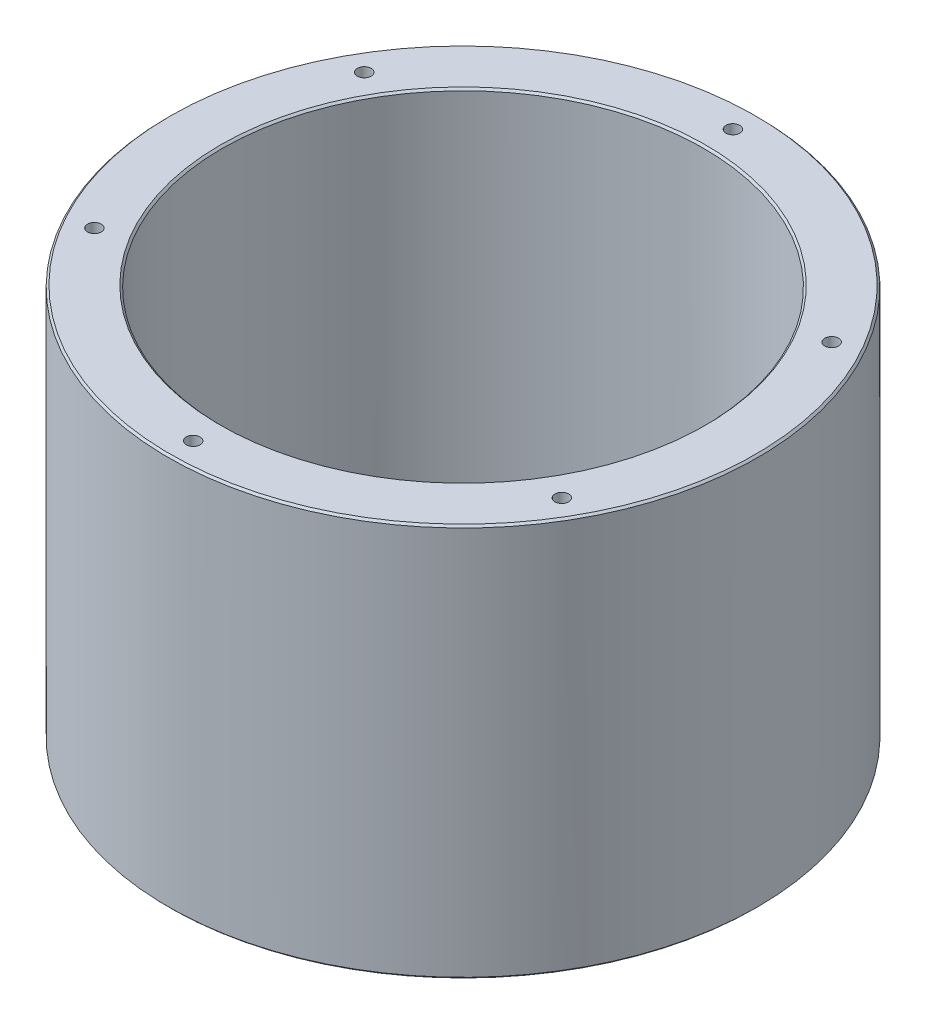
from build123d import *

# Parameters (mm, degrees)
SZKIC1_W                            = 27.5
SZKIC1_H                            = 200
SFAZOWANIE1_SIZE                    = 1
OTW_R_GWINTOWANY_M8X1_01_AT_2_COUNT = 2
OTW_R_GWINTOWANY_M8X1_01_AT_2_PITCH = 137.316
OTW_R_GWINTOWANY_M8X1_01_AT_3_COUNT = 2
OTW_R_GWINTOWANY_M8X1_01_AT_3_PITCH = 237.838288692
OTW_R_GWINTOWANY_M8X1_01_AT_4_COUNT = 2
OTW_R_GWINTOWANY_M8X1_01_AT_4_PITCH = 274.632
OTW_R_GWINTOWANY_M8X1_01_AT_5_COUNT = 2
OTW_R_GWINTOWANY_M8X1_01_AT_5_PITCH = 237.838288692
OTW_R_GWINTOWANY_M8X1_01_AT_6_COUNT = 2
OTW_R_GWINTOWANY_M8X1_01_AT_6_PITCH = 137.316


with BuildPart() as part:
    # Szkic1 → Obrót1 (revolve)
    with BuildSketch(Plane.XY):
        with Locations((-136.25, 73.59625624)):
            Rectangle(SZKIC1_W, SZKIC1_H)
    revolve(axis=Axis((0, 193.59625624, 0), (0, -1, 0)))

    # Sfazowanie1
    sfazowanie1_edges = [part.edges().sort_by_distance(p)[0] for p in [
        (150, 173.59625624, 0),
        (122.5, 173.59625624, 0),
        (122.5, -26.40374376, 0),
        (150, -26.40374376, 0),
    ]]
    chamfer(sfazowanie1_edges, length=SFAZOWANIE1_SIZE)

    # Szkic7 → Otwór gwintowany M8x1.01 (revolve, cut)
    with BuildSketch(Plane(origin=(0, 173.59625624, -137.316), x_dir=(0, 0, 1), z_dir=(1, 0, 0))):
        Polygon((0, 0), (0, 77.103012167), (3.5, 75), (3.5, 0), align=None)
    otw_r_gwintowany_m8x1_01 = revolve(axis=Axis((0, 179.94625624, -137.316), (0, -1, 0)), mode=Mode.SUBTRACT)

    # Otwór gwintowany M8x1.01 at 2: Otwór gwintowany M8x1.01 ×2
    with Locations(*[Vector(0.8660254037844388, 0, 0.49999999999999983) * (i * OTW_R_GWINTOWANY_M8X1_01_AT_2_PITCH) for i in range(1, OTW_R_GWINTOWANY_M8X1_01_AT_2_COUNT)]):
        add(otw_r_gwintowany_m8x1_01, mode=Mode.SUBTRACT)

    # Otwór gwintowany M8x1.01 at 3: Otwór gwintowany M8x1.01 ×2
    with Locations(*[Vector(0.5000000000000001, 0, 0.8660254037844386) * (i * OTW_R_GWINTOWANY_M8X1_01_AT_3_PITCH) for i in range(1, OTW_R_GWINTOWANY_M8X1_01_AT_3_COUNT)]):
        add(otw_r_gwintowany_m8x1_01, mode=Mode.SUBTRACT)

    # Otwór gwintowany M8x1.01 at 4: Otwór gwintowany M8x1.01 ×2
    with Locations(*[(0, 0, i * OTW_R_GWINTOWANY_M8X1_01_AT_4_PITCH) for i in range(1, OTW_R_GWINTOWANY_M8X1_01_AT_4_COUNT)]):
        add(otw_r_gwintowany_m8x1_01, mode=Mode.SUBTRACT)

    # Otwór gwintowany M8x1.01 at 5: Otwór gwintowany M8x1.01 ×2
    with Locations(*[Vector(-0.49999999999999967, 0, 0.8660254037844388) * (i * OTW_R_GWINTOWANY_M8X1_01_AT_5_PITCH) for i in range(1, OTW_R_GWINTOWANY_M8X1_01_AT_5_COUNT)]):
        add(otw_r_gwintowany_m8x1_01, mode=Mode.SUBTRACT)

    # Otwór gwintowany M8x1.01 at 6: Otwór gwintowany M8x1.01 ×2
    with Locations(*[Vector(-0.8660254037844386, 0, 0.5000000000000002) * (i * OTW_R_GWINTOWANY_M8X1_01_AT_6_PITCH) for i in range(1, OTW_R_GWINTOWANY_M8X1_01_AT_6_COUNT)]):
        add(otw_r_gwintowany_m8x1_01, mode=Mode.SUBTRACT)

    # Lustro2: Otwór gwintowany M8x1.01 across plane
    add(otw_r_gwintowany_m8x1_01.mirror(Plane.ZX.offset(73.59625624)), mode=Mode.SUBTRACT)

    # Lustro2 copy 1 sketch → Lustro2 copy 1 (revolve, cut)
    with BuildSketch(Plane(origin=(118.919144346, -26.40374376, -68.658), x_dir=(0, 0, 1), z_dir=(1, 0, 0))):
        Polygon((0, 0), (0, -77.103012167), (3.5, -75), (3.5, 0), align=None)
    revolve(axis=Axis((118.919144346, -32.75374376, -68.658), (0, -1, 0)), mode=Mode.SUBTRACT)

    # Lustro2 copy 2 sketch → Lustro2 copy 2 (revolve, cut)
    with BuildSketch(Plane(origin=(118.919144346, -26.40374376, 68.658), x_dir=(0, 0, 1), z_dir=(1, 0, 0))):
        Polygon((0, 0), (0, -77.103012167), (3.5, -75), (3.5, 0), align=None)
    revolve(axis=Axis((118.919144346, -32.75374376, 68.658), (0, -1, 0)), mode=Mode.SUBTRACT)

    # Lustro2 copy 3 sketch → Lustro2 copy 3 (revolve, cut)
    with BuildSketch(Plane(origin=(0, -26.40374376, 137.316), x_dir=(0, 0, 1), z_dir=(1, 0, 0))):
        Polygon((0, 0), (0, -77.103012167), (3.5, -75), (3.5, 0), align=None)
    revolve(axis=Axis((0, -32.75374376, 137.316), (0, -1, 0)), mode=Mode.SUBTRACT)

    # Lustro2 copy 4 sketch → Lustro2 copy 4 (revolve, cut)
    with BuildSketch(Plane(origin=(-118.919144346, -26.40374376, 68.658), x_dir=(0, 0, 1), z_dir=(1, 0, 0))):
        Polygon((0, 0), (0, -77.103012167), (3.5, -75), (3.5, 0), align=None)
    revolve(axis=Axis((-118.919144346, -32.75374376, 68.658), (0, -1, 0)), mode=Mode.SUBTRACT)

    # Lustro2 copy 5 sketch → Lustro2 copy 5 (revolve, cut)
    with BuildSketch(Plane(origin=(-118.919144346, -26.40374376, -68.658), x_dir=(0, 0, 1), z_dir=(1, 0, 0))):
        Polygon((0, 0), (0, -77.103012167), (3.5, -75), (3.5, 0), align=None)
    revolve(axis=Axis((-118.919144346, -32.75374376, -68.658), (0, -1, 0)), mode=Mode.SUBTRACT)


solid = part.part
